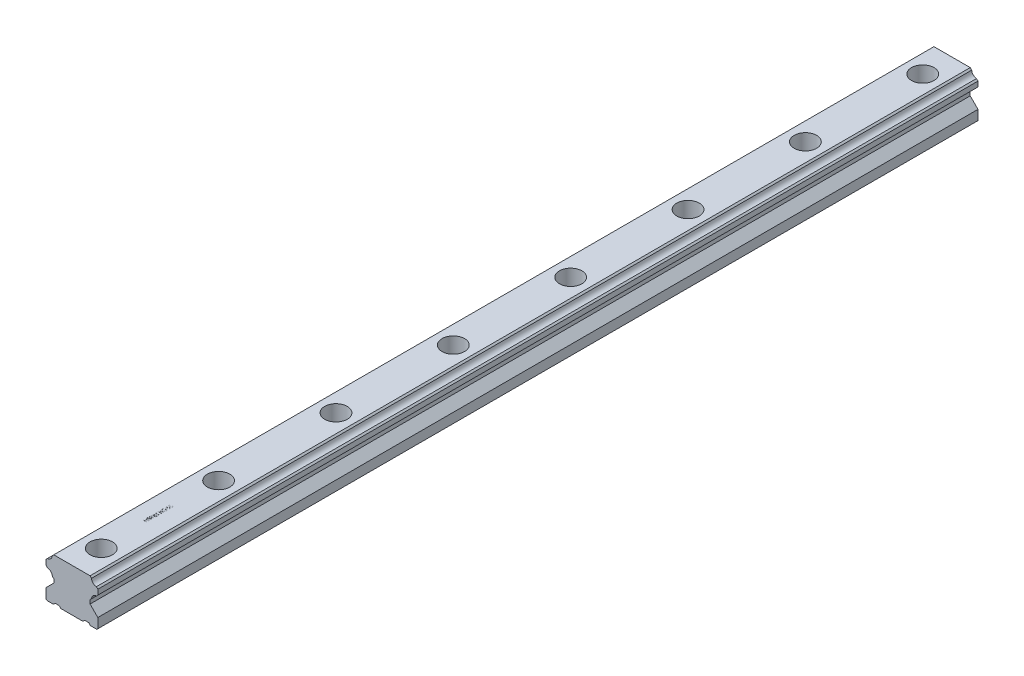
from build123d import *

# Parameters (mm, degrees)
EXTRUDE_1_DEPTH           = 900
HOLE_WIZARD_1_D           = 16
HOLE_WIZARD_1_CBORE_D     = 23
HOLE_WIZARD_1_CBORE_DEPTH = 20
PATTERN_LINEAR_1_COUNT    = 8
PATTERN_LINEAR_1_PITCH    = 120
SKETCH_6_W                = 3.5
SKETCH_6_H                = 0.314102564
CUT_EXTRUDE_1_DEPTH       = 0.1


with BuildPart() as part:
    # 草图1 → 凸台-拉伸1 (new body)
    with BuildSketch(Plane.XY):
        with BuildLine():
            Line((26.5, 36.05), (25.003848019, 37.546151981))
            ThreePointArc((25.003848019, 37.546151981), (21.588083515, 39.088083515), (20.046151981, 42.503848019))
            Line((20.046151981, 42.503848019), (18.55, 44))
            Line((18.55, 44), (-18.55, 44))
            Line((-18.55, 44), (-20.046151981, 42.503848019))
            ThreePointArc((-20.046151981, 42.503848019), (-21.588083515, 39.088083515), (-25.003848019, 37.546151981))
            Line((-25.003848019, 37.546151981), (-26.5, 36.05))
            Line((-26.5, 36.05), (-26.5, 30.8))
            Line((-26.5, 30.8), (-25.003848019, 29.303848019))
            ThreePointArc((-25.003848019, 29.303848019), (-21.588083515, 27.761916485), (-20.046151981, 24.346151981))
            Line((-20.046151981, 24.346151981), (-18.55, 22.85))
            Line((-18.55, 22.85), (-18.55, 18.95))
            Line((-18.55, 18.95), (-26.5, 11))
            Line((-26.5, 11), (-26.5, 1))
            Line((-26.5, 1), (-25.5, 0))
            Line((-25.5, 0), (-18.928571429, 0))
            Line((-18.928571429, 0), (-17.161904762, 1.766666667))
            Line((-17.161904762, 1.766666667), (-13.123809524, 1.766666667))
            Line((-13.123809524, 1.766666667), (-11.357142857, 0))
            Line((-11.357142857, 0), (11.357142857, 0))
            Line((11.357142857, 0), (13.123809524, 1.766666667))
            Line((13.123809524, 1.766666667), (17.161904762, 1.766666667))
            Line((17.161904762, 1.766666667), (18.928571429, 0))
            Line((18.928571429, 0), (25.5, 0))
            Line((25.5, 0), (26.5, 1))
            Line((26.5, 1), (26.5, 11))
            Line((26.5, 11), (18.55, 18.95))
            Line((18.55, 18.95), (18.55, 22.85))
            Line((18.55, 22.85), (20.046151981, 24.346151981))
            ThreePointArc((20.046151981, 24.346151981), (21.588083515, 27.761916485), (25.003848019, 29.303848019))
            Line((25.003848019, 29.303848019), (26.5, 30.8))
            Line((26.5, 30.8), (26.5, 36.05))
        make_face()
    extrude(amount=-EXTRUDE_1_DEPTH)

    # 打孔尺寸根据内六角圆柱头螺钉的类型1 (through all)
    with Locations(Plane(origin=(-6.515963484, 44, -115.068961562), x_dir=(-1, 0, 0), z_dir=(0, 1, 0))):
        with Locations((-6.515963484, 85.068961562)):
            hole_wizard_1 = CounterBoreHole(HOLE_WIZARD_1_D / 2, HOLE_WIZARD_1_CBORE_D / 2, HOLE_WIZARD_1_CBORE_DEPTH)

    # 阵列(线性)1: 打孔尺寸根据内六角圆柱头螺钉的类型1 ×8
    with Locations(*[(0, 0, -i * PATTERN_LINEAR_1_PITCH) for i in range(1, PATTERN_LINEAR_1_COUNT)]):
        add(hole_wizard_1, mode=Mode.SUBTRACT)

    # 草图6 → 切除-拉伸1 (cut)
    with BuildSketch(Plane(origin=(0, 44, 0), x_dir=(1, 0, 0), z_dir=(0, 1, 0))):
        Polygon((-3.5, 76.403846154), (-3.5, 76.717948718), (-2.064102564, 76.717948718), (-2.064102564, 78.512820513), (-3.5, 78.512820513), (-3.5, 78.826923077), (0, 78.826923077), (0, 78.512820513), (-1.705128205, 78.512820513), (-1.705128205, 76.717948718), (0, 76.717948718), (0, 76.403846154), align=None)
        with Locations((-1.75, 79.881410256)):
            Rectangle(SKETCH_6_W, SKETCH_6_H)
        Polygon((-3.5, 80.576923077), (-3.5, 80.901542468), (-0.933193109, 81.586538462), (-3.5, 82.605268429), (-3.5, 82.650841346), (-0.950721154, 83.650641026), (-3.5, 84.339142628), (-3.5, 84.66025641), (0, 83.716546474), (0, 83.671674679), (-2.676883013, 82.618589744), (0, 81.552884615), (0, 81.508012821), align=None)
        with Locations((-1.75, 85.625)):
            Rectangle(SKETCH_6_W, SKETCH_6_H)
        Polygon((0, 86.544871795), (-3.5, 86.544871795), (-3.5, 86.610777244), (-0.745292468, 88.923076923), (-3.5, 88.923076923), (-3.5, 89.237179487), (0, 89.237179487), (0, 89.165665064), (-2.748397436, 86.858974359), (0, 86.858974359), align=None)
        Polygon((-3.5, 91.480769231), (-3.5, 91.794871795), (-2.064102564, 91.794871795), (-2.064102564, 93.58974359), (-3.5, 93.58974359), (-3.5, 93.903846154), (0, 93.903846154), (0, 93.58974359), (-1.705128205, 93.58974359), (-1.705128205, 91.794871795), (0, 91.794871795), (0, 91.480769231), align=None)
        with BuildLine():
            Line((-2.902644231, 98.076923077), (-2.647435897, 97.807692308))
            add(Edge.make_bspline(
                [(-2.647435897, 97.807692308), (-2.69328212, 97.758983227), (-2.783881335, 97.662726562), (-2.901244074, 97.50552662), (-3.002777003, 97.342170767), (-3.084772592, 97.172394867), (-3.149094254, 97.000650867), (-3.195850217, 96.829891913), (-3.225460377, 96.661223615), (-3.229016796, 96.549059313), (-3.230769231, 96.493790064)],
                knots=[0, 0, 0, 0, 1.089067066, 2.152164705, 3.18986567, 4.218445106, 5.218487318, 6.173592265, 7.100032889, 8, 8, 8, 8], degree=3))
            add(Edge.make_bspline(
                [(-3.230769231, 96.493790064), (-3.230355625, 96.459875364), (-3.229529486, 96.392133924), (-3.218985271, 96.29151198), (-3.203820407, 96.191945342), (-3.181878529, 96.093621968), (-3.15406947, 95.99635068), (-3.119284004, 95.900469793), (-3.078728771, 95.805800421), (-3.031866252, 95.713234402), (-2.980386575, 95.623493669), (-2.923337414, 95.538737672), (-2.862550889, 95.458421211), (-2.796491613, 95.384072004), (-2.725807311, 95.31519549), (-2.651770944, 95.250524789), (-2.572926872, 95.191265211), (-2.489599321, 95.138479571), (-2.403726867, 95.090811977), (-2.316037795, 95.049619777), (-2.227346143, 95.013809823), (-2.136984078, 94.986535862), (-2.045883197, 94.963434988), (-1.953566086, 94.947353752), (-1.859791669, 94.938257435), (-1.796993971, 94.936686944), (-1.765424679, 94.935897436)],
                knots=[0, 0, 0, 0, 1.028150113, 2.053633673, 3.06513288, 4.081487945, 5.106702018, 6.131327874, 7.172780699, 8.228344599, 9.276313556, 10.308389736, 11.324843658, 12.329040066, 13.321460474, 14.316307835, 15.308626991, 16.309440696, 17.305625405, 18.28535951, 19.246194545, 20.203493668, 21.145557131, 22.095268976, 23.042464743, 24, 24, 24, 24], degree=3))
            add(Edge.make_bspline(
                [(-1.765424679, 94.935897436), (-1.733154018, 94.936653631), (-1.668700816, 94.938163957), (-1.572504414, 94.947817154), (-1.477747832, 94.965772364), (-1.384282029, 94.989584114), (-1.291920993, 95.019856789), (-1.20076111, 95.057049303), (-1.110811241, 95.101355435), (-1.022964324, 95.152526704), (-0.937464192, 95.209036172), (-0.856251713, 95.271187356), (-0.780271995, 95.339084893), (-0.708415252, 95.411483836), (-0.641134974, 95.489043832), (-0.579242122, 95.572517364), (-0.521779643, 95.660735956), (-0.469378807, 95.753738745), (-0.42257144, 95.850542725), (-0.38094723, 95.949799156), (-0.346667976, 96.051827058), (-0.31872985, 96.156089724), (-0.295829559, 96.262463002), (-0.281097077, 96.371486803), (-0.270406246, 96.482359512), (-0.269624576, 96.557098144), (-0.269230769, 96.594751603)],
                knots=[0, 0, 0, 0, 0.935915162, 1.869274651, 2.799799983, 3.730201895, 4.664668062, 5.616159355, 6.583070886, 7.570012957, 8.562524459, 9.553461134, 10.53281078, 11.515274572, 12.509912756, 13.507571325, 14.526460018, 15.561318395, 16.601025881, 17.643204557, 18.680545676, 19.719612342, 20.772381578, 21.833430283, 22.908478249, 24, 24, 24, 24], degree=3))
            add(Edge.make_bspline(
                [(-0.269230769, 96.594751603), (-0.270178952, 96.640130135), (-0.272040863, 96.729238255), (-0.286546735, 96.860222075), (-0.309173205, 96.986034693), (-0.342412256, 97.106266531), (-0.384484705, 97.221353926), (-0.436513285, 97.330872414), (-0.497950569, 97.435124408), (-0.567552463, 97.533658668), (-0.645100929, 97.624132689), (-0.728035637, 97.706474768), (-0.817431068, 97.77785339), (-0.911954918, 97.840400707), (-1.012511326, 97.892097951), (-1.118540888, 97.934543829), (-1.230109213, 97.967076285), (-1.307200733, 97.980431374), (-1.346153846, 97.987179487)],
                knots=[0, 0, 0, 0, 1.130199668, 2.219330667, 3.279027493, 4.311506524, 5.322739849, 6.327972234, 7.327472899, 8.33386792, 9.329086447, 10.29244429, 11.240784345, 12.174119183, 13.111530729, 14.052100829, 15.015757696, 16, 16, 16, 16], degree=3))
            Line((-1.346153846, 97.987179487), (-1.346153846, 96.820512821))
            Line((-1.346153846, 96.820512821), (-1.705128205, 96.820512821))
            Line((-1.705128205, 96.820512821), (-1.705128205, 98.301282051))
            add(Edge.make_bspline(
                [(-1.705128205, 98.301282051), (-1.638220716, 98.299576203), (-1.507270675, 98.296237549), (-1.316300404, 98.272818634), (-1.13592871, 98.235002122), (-0.965965639, 98.18334181), (-0.806652046, 98.116466529), (-0.65782618, 98.035094001), (-0.520449499, 97.93792188), (-0.393400495, 97.828411438), (-0.280071283, 97.705511481), (-0.180465345, 97.572542861), (-0.09656273, 97.429285892), (-0.028302067, 97.275876085), (0.024971927, 97.112815651), (0.062743504, 96.939727272), (0.085373467, 96.756845671), (0.088264847, 96.631508994), (0.08974359, 96.567407853)],
                knots=[0, 0, 0, 0, 1.140356446, 2.231883559, 3.274166699, 4.278491846, 5.25512956, 6.21435461, 7.1637429, 8.11826594, 9.068280886, 10.0076534, 10.945064095, 11.891975133, 12.864533718, 13.863980011, 14.907571808, 16, 16, 16, 16], degree=3))
            add(Edge.make_bspline(
                [(0.08974359, 96.567407853), (0.089174469, 96.527897717), (0.088051978, 96.449970996), (0.080074631, 96.334880068), (0.067794054, 96.222962448), (0.049248931, 96.114234439), (0.026534277, 96.008296097), (-0.002552442, 95.905676512), (-0.036221141, 95.80598477), (-0.074516815, 95.709066784), (-0.118888472, 95.615802237), (-0.168198111, 95.52577572), (-0.222191472, 95.438489595), (-0.281802318, 95.35453843), (-0.346584778, 95.273484808), (-0.416668697, 95.195851364), (-0.491839816, 95.121203486), (-0.545218826, 95.074443023), (-0.572115385, 95.05088141)],
                knots=[0, 0, 0, 0, 1.107784379, 2.184907829, 3.233506516, 4.263428166, 5.276301166, 6.270063455, 7.25232949, 8.225834625, 9.190232166, 10.146266622, 11.1027726, 12.066435141, 13.031522626, 14.010570082, 14.99756817, 16, 16, 16, 16], degree=3))
            add(Edge.make_bspline(
                [(-0.572115385, 95.05088141), (-0.614786038, 95.016695478), (-0.699419055, 94.948891066), (-0.835018999, 94.861612909), (-0.975420859, 94.787211506), (-1.121015488, 94.726843684), (-1.271666701, 94.679705598), (-1.427181992, 94.645899345), (-1.587761622, 94.626092056), (-1.696426887, 94.623238518), (-1.751402244, 94.621794872)],
                knots=[0, 0, 0, 0, 1.023165419, 2.029347347, 3.013907458, 3.994755782, 4.975994455, 5.96558838, 6.970761222, 8, 8, 8, 8], degree=3))
            add(Edge.make_bspline(
                [(-1.751402244, 94.621794872), (-1.792568496, 94.62232711), (-1.874377804, 94.623384821), (-1.99583511, 94.636210339), (-2.115135808, 94.654611751), (-2.232182344, 94.681658827), (-2.347053012, 94.715755013), (-2.45980069, 94.758308794), (-2.570493643, 94.807852572), (-2.67836343, 94.865442289), (-2.782003044, 94.929511026), (-2.880905313, 94.999118682), (-2.973467332, 95.074802367), (-3.059903521, 95.156782462), (-3.141494975, 95.243406392), (-3.216537375, 95.336492693), (-3.286205011, 95.434631029), (-3.349159221, 95.538582169), (-3.405727075, 95.6467058), (-3.455315154, 95.758766886), (-3.496298775, 95.874724704), (-3.531072472, 95.993712261), (-3.556787635, 96.11662974), (-3.575436374, 96.242585283), (-3.588196976, 96.372235393), (-3.589223231, 96.459871423), (-3.58974359, 96.504306891)],
                knots=[0, 0, 0, 0, 1.00895651, 2.005089799, 2.991467152, 3.967318338, 4.948153826, 5.927364234, 6.919980553, 7.91976625, 8.923240147, 9.905815003, 10.88314567, 11.851989312, 12.825009789, 13.798721852, 14.781296708, 15.773896486, 16.776076962, 17.771600213, 18.775744723, 19.78957137, 20.808953803, 21.851964491, 22.910847925, 24, 24, 24, 24], degree=3))
            add(Edge.make_bspline(
                [(-3.58974359, 96.504306891), (-3.589164098, 96.540545135), (-3.588015034, 96.612401313), (-3.580050386, 96.719327046), (-3.567426505, 96.82460006), (-3.550199718, 96.92837645), (-3.526736028, 97.030302816), (-3.498657743, 97.130669522), (-3.46596592, 97.229622058), (-3.426977074, 97.326850307), (-3.382723449, 97.423008023), (-3.332910027, 97.518629864), (-3.276685022, 97.61338911), (-3.213881487, 97.707450091), (-3.145578069, 97.801405949), (-3.069821245, 97.893770591), (-2.989598489, 97.986773536), (-2.931916305, 98.04657535), (-2.902644231, 98.076923077)],
                knots=[0, 0, 0, 0, 0.985871117, 1.954866573, 2.915460327, 3.869826059, 4.81536089, 5.759505086, 6.70452669, 7.649098992, 8.607881297, 9.583363685, 10.581137262, 11.603961102, 12.659522466, 13.73993555, 14.853081303, 16, 16, 16, 16], degree=3))
        make_face()
        with BuildLine():
            Line((-3.5, 100.903846154), (-3.141025641, 100.903846154))
            Line((-3.141025641, 100.903846154), (-3.141025641, 99.713341346))
            Line((-3.141025641, 99.713341346), (-2.220452724, 99.524739583))
            add(Edge.make_bspline(
                [(-2.220452724, 99.524739583), (-2.230682996, 99.561795458), (-2.25050253, 99.633585354), (-2.2725083, 99.739545215), (-2.285773744, 99.840137418), (-2.287585055, 99.905412788), (-2.288461538, 99.936999199)],
                knots=[0, 0, 0, 0, 1.100273476, 2.13160584, 3.095893838, 4, 4, 4, 4], degree=3))
            add(Edge.make_bspline(
                [(-2.288461538, 99.936999199), (-2.28764354, 99.976090113), (-2.28603515, 100.052952616), (-2.269673986, 100.165236922), (-2.245976174, 100.272964258), (-2.209465207, 100.37454404), (-2.164878805, 100.471583362), (-2.108721258, 100.562415693), (-2.04315746, 100.648315868), (-1.968525078, 100.728690187), (-1.885534459, 100.801263185), (-1.795933934, 100.864326729), (-1.701678739, 100.919369504), (-1.600559725, 100.962297929), (-1.494484031, 100.997331711), (-1.382227183, 101.020433075), (-1.264785773, 101.035863785), (-1.18448027, 101.037584225), (-1.143529647, 101.038461538)],
                knots=[0, 0, 0, 0, 1.052805225, 2.070078116, 3.052532748, 4.020689046, 4.973125432, 5.925915817, 6.89216474, 7.881560752, 8.877013184, 9.857446635, 10.830895175, 11.812622661, 12.812548702, 13.836681939, 14.896847428, 16, 16, 16, 16], degree=3))
            add(Edge.make_bspline(
                [(-1.143529647, 101.038461538), (-1.115007605, 101.037795864), (-1.058348972, 101.036473511), (-0.974202158, 101.029763707), (-0.891849045, 101.016795315), (-0.811440613, 100.999595198), (-0.732901554, 100.976633891), (-0.65579213, 100.949776469), (-0.580956685, 100.91639447), (-0.508064701, 100.879386796), (-0.437950402, 100.838407772), (-0.372294905, 100.79232777), (-0.309599937, 100.744447993), (-0.251727444, 100.692130497), (-0.198452948, 100.635970103), (-0.149513072, 100.576279294), (-0.104029493, 100.513599475), (-0.063861909, 100.446943445), (-0.026898788, 100.377801175), (0.003424705, 100.3051729), (0.030535245, 100.230712215), (0.05214477, 100.153347336), (0.069077325, 100.073253524), (0.080577925, 99.990298748), (0.088954363, 99.904918078), (0.08947872, 99.847043066), (0.08974359, 99.817808494)],
                knots=[0, 0, 0, 0, 1.056393913, 2.098511576, 3.122979385, 4.141471433, 5.141222888, 6.151259816, 7.162667642, 8.172852865, 9.177685681, 10.166741883, 11.141342384, 12.097242845, 13.052202613, 14.005160326, 14.953864445, 15.917140761, 16.884916217, 17.854238259, 18.828761908, 19.81781811, 20.826036654, 21.857789401, 22.917898972, 24, 24, 24, 24], degree=3))
            add(Edge.make_bspline(
                [(0.08974359, 99.817808494), (0.089050894, 99.782935202), (0.087688097, 99.714326121), (0.073496095, 99.613792878), (0.053035464, 99.517124563), (0.022721931, 99.424735484), (-0.016971483, 99.337010956), (-0.064133263, 99.252694783), (-0.12027864, 99.172832026), (-0.184894072, 99.097968685), (-0.255892818, 99.029152679), (-0.332202561, 98.966749818), (-0.413920487, 98.911886181), (-0.500780871, 98.864362752), (-0.592629648, 98.823877123), (-0.689749822, 98.792058716), (-0.791650601, 98.766381298), (-0.861804004, 98.755517748), (-0.897435897, 98.75)],
                knots=[0, 0, 0, 0, 1.046872515, 2.059598001, 3.044168548, 4.012104806, 4.973680974, 5.932408326, 6.910122221, 7.900780896, 8.89867654, 9.876692837, 10.858029398, 11.85084981, 12.847361615, 13.868568023, 14.917415949, 16, 16, 16, 16], degree=3))
            Line((-0.897435897, 98.75), (-0.897435897, 99.064102564))
            add(Edge.make_bspline(
                [(-0.897435897, 99.064102564), (-0.86405597, 99.071826286), (-0.799897896, 99.08667171), (-0.709812799, 99.119341801), (-0.62950762, 99.158898767), (-0.558491359, 99.207032704), (-0.495464081, 99.2628261), (-0.43989307, 99.327683039), (-0.389697273, 99.399982119), (-0.347784769, 99.480364497), (-0.312479137, 99.56533256), (-0.287283878, 99.653755658), (-0.272032646, 99.744361212), (-0.270168243, 99.805363831), (-0.269230769, 99.83603766)],
                knots=[0, 0, 0, 0, 1.13623081, 2.183898708, 3.172478118, 4.09966615, 5.022692284, 5.957376522, 6.927682873, 7.937366477, 8.960015386, 9.976409503, 10.982481913, 12, 12, 12, 12], degree=3))
            add(Edge.make_bspline(
                [(-0.269230769, 99.83603766), (-0.270058415, 99.865993563), (-0.271688055, 99.924976981), (-0.284028564, 100.01182482), (-0.303533592, 100.095428074), (-0.33085902, 100.175935151), (-0.367008958, 100.252950452), (-0.411417074, 100.326365089), (-0.462975425, 100.397224915), (-0.521904738, 100.463665008), (-0.586881759, 100.52450125), (-0.656357238, 100.578258209), (-0.730474586, 100.623034903), (-0.807947606, 100.66076907), (-0.889626199, 100.689422353), (-0.975127364, 100.709863339), (-1.064662347, 100.721866396), (-1.125731657, 100.723517577), (-1.156850962, 100.724358974)],
                knots=[0, 0, 0, 0, 1.027268864, 2.022700798, 3.002744649, 3.968653148, 4.933396556, 5.915045722, 6.907600446, 7.935526002, 8.956456544, 9.95700807, 10.942805781, 11.92166854, 12.907987664, 13.905483474, 14.932689774, 16, 16, 16, 16], degree=3))
            add(Edge.make_bspline(
                [(-1.156850962, 100.724358974), (-1.184930032, 100.723720502), (-1.239659043, 100.722476054), (-1.320009695, 100.71170295), (-1.396158478, 100.693706649), (-1.468436727, 100.668083572), (-1.536613353, 100.636105153), (-1.600538112, 100.595955279), (-1.660812066, 100.549343566), (-1.715884112, 100.494925447), (-1.766793088, 100.435729798), (-1.810034281, 100.370236173), (-1.846807397, 100.300193009), (-1.876936465, 100.225470504), (-1.900936575, 100.145976618), (-1.917523378, 100.061668535), (-1.92744867, 99.972527041), (-1.928795087, 99.911551397), (-1.929487179, 99.880208333)],
                knots=[0, 0, 0, 0, 1.045723156, 2.038222538, 3.013889863, 3.95567481, 4.890389958, 5.81331128, 6.76251276, 7.723027653, 8.692928204, 9.666105983, 10.639751036, 11.635719707, 12.66315958, 13.728667616, 14.832476222, 16, 16, 16, 16], degree=3))
            add(Edge.make_bspline(
                [(-1.929487179, 99.880208333), (-1.928906588, 99.853079405), (-1.927707815, 99.797065049), (-1.918881318, 99.711142222), (-1.904642024, 99.620850499), (-1.885055776, 99.526536004), (-1.859424699, 99.427915496), (-1.828710199, 99.325197095), (-1.7919882, 99.218164829), (-1.764255986, 99.146047104), (-1.75, 99.108974359)],
                knots=[0, 0, 0, 0, 0.817624296, 1.688186739, 2.600797293, 3.572016777, 4.590301741, 5.671205678, 6.80286297, 8, 8, 8, 8], degree=3))
            Line((-1.75, 99.108974359), (-3.5, 99.467948718))
            Line((-3.5, 99.467948718), (-3.5, 100.903846154))
        make_face()
        with BuildLine():
            Line((-3.5, 103.596153846), (-3.141025641, 103.596153846))
            Line((-3.141025641, 103.596153846), (-3.141025641, 102.405649038))
            Line((-3.141025641, 102.405649038), (-2.220452724, 102.217047276))
            add(Edge.make_bspline(
                [(-2.220452724, 102.217047276), (-2.230682996, 102.25410315), (-2.25050253, 102.325893046), (-2.2725083, 102.431852907), (-2.285773744, 102.53244511), (-2.287585055, 102.597720481), (-2.288461538, 102.629306891)],
                knots=[0, 0, 0, 0, 1.100273476, 2.13160584, 3.095893838, 4, 4, 4, 4], degree=3))
            add(Edge.make_bspline(
                [(-2.288461538, 102.629306891), (-2.28764354, 102.668397805), (-2.28603515, 102.745260309), (-2.269673986, 102.857544614), (-2.245976174, 102.96527195), (-2.209465207, 103.066851732), (-2.164878805, 103.163891055), (-2.108721258, 103.254723386), (-2.04315746, 103.34062356), (-1.968525078, 103.420997879), (-1.885534459, 103.493570878), (-1.795933934, 103.556634421), (-1.701678739, 103.611677196), (-1.600559725, 103.654605621), (-1.494484031, 103.689639403), (-1.382227183, 103.712740767), (-1.264785773, 103.728171477), (-1.18448027, 103.729891917), (-1.143529647, 103.730769231)],
                knots=[0, 0, 0, 0, 1.052805225, 2.070078116, 3.052532748, 4.020689046, 4.973125432, 5.925915817, 6.89216474, 7.881560752, 8.877013184, 9.857446635, 10.830895175, 11.812622661, 12.812548702, 13.836681939, 14.896847428, 16, 16, 16, 16], degree=3))
            add(Edge.make_bspline(
                [(-1.143529647, 103.730769231), (-1.115007605, 103.730103556), (-1.058348972, 103.728781204), (-0.974202158, 103.7220714), (-0.891849045, 103.709103007), (-0.811440613, 103.69190289), (-0.732901554, 103.668941583), (-0.65579213, 103.642084161), (-0.580956685, 103.608702163), (-0.508064701, 103.571694489), (-0.437950402, 103.530715464), (-0.372294905, 103.484635462), (-0.309599937, 103.436755685), (-0.251727444, 103.384438189), (-0.198452948, 103.328277796), (-0.149513072, 103.268586987), (-0.104029493, 103.205907167), (-0.063861909, 103.139251137), (-0.026898788, 103.070108867), (0.003424705, 102.997480593), (0.030535245, 102.923019908), (0.05214477, 102.845655028), (0.069077325, 102.765561217), (0.080577925, 102.682606441), (0.088954363, 102.597225771), (0.08947872, 102.539350758), (0.08974359, 102.510116186)],
                knots=[0, 0, 0, 0, 1.056393913, 2.098511576, 3.122979385, 4.141471433, 5.141222888, 6.151259816, 7.162667642, 8.172852865, 9.177685681, 10.166741883, 11.141342384, 12.097242845, 13.052202613, 14.005160326, 14.953864445, 15.917140761, 16.884916217, 17.854238259, 18.828761908, 19.81781811, 20.826036654, 21.857789401, 22.917898972, 24, 24, 24, 24], degree=3))
            add(Edge.make_bspline(
                [(0.08974359, 102.510116186), (0.089050894, 102.475242894), (0.087688097, 102.406633813), (0.073496095, 102.30610057), (0.053035464, 102.209432256), (0.022721931, 102.117043177), (-0.016971483, 102.029318648), (-0.064133263, 101.945002475), (-0.12027864, 101.865139718), (-0.184894072, 101.790276377), (-0.255892818, 101.721460371), (-0.332202561, 101.65905751), (-0.413920487, 101.604193873), (-0.500780871, 101.556670445), (-0.592629648, 101.516184815), (-0.689749822, 101.484366409), (-0.791650601, 101.45868899), (-0.861804004, 101.447825441), (-0.897435897, 101.442307692)],
                knots=[0, 0, 0, 0, 1.046872515, 2.059598001, 3.044168548, 4.012104806, 4.973680974, 5.932408326, 6.910122221, 7.900780896, 8.89867654, 9.876692837, 10.858029398, 11.85084981, 12.847361615, 13.868568023, 14.917415949, 16, 16, 16, 16], degree=3))
            Line((-0.897435897, 101.442307692), (-0.897435897, 101.756410256))
            add(Edge.make_bspline(
                [(-0.897435897, 101.756410256), (-0.86405597, 101.764133979), (-0.799897896, 101.778979402), (-0.709812799, 101.811649494), (-0.62950762, 101.851206459), (-0.558491359, 101.899340396), (-0.495464081, 101.955133792), (-0.43989307, 102.019990731), (-0.389697273, 102.092289811), (-0.347784769, 102.17267219), (-0.312479137, 102.257640252), (-0.287283878, 102.346063351), (-0.272032646, 102.436668904), (-0.270168243, 102.497671524), (-0.269230769, 102.528345353)],
                knots=[0, 0, 0, 0, 1.13623081, 2.183898708, 3.172478118, 4.09966615, 5.022692284, 5.957376522, 6.927682873, 7.937366477, 8.960015386, 9.976409503, 10.982481913, 12, 12, 12, 12], degree=3))
            add(Edge.make_bspline(
                [(-0.269230769, 102.528345353), (-0.270058415, 102.558301256), (-0.271688055, 102.617284674), (-0.284028564, 102.704132513), (-0.303533592, 102.787735767), (-0.33085902, 102.868242843), (-0.367008958, 102.945258145), (-0.411417074, 103.018672781), (-0.462975425, 103.089532607), (-0.521904738, 103.1559727), (-0.586881759, 103.216808942), (-0.656357238, 103.270565902), (-0.730474586, 103.315342595), (-0.807947606, 103.353076763), (-0.889626199, 103.381730046), (-0.975127364, 103.402171031), (-1.064662347, 103.414174089), (-1.125731657, 103.415825269), (-1.156850962, 103.416666667)],
                knots=[0, 0, 0, 0, 1.027268864, 2.022700798, 3.002744649, 3.968653148, 4.933396556, 5.915045722, 6.907600446, 7.935526002, 8.956456544, 9.95700807, 10.942805781, 11.92166854, 12.907987664, 13.905483474, 14.932689774, 16, 16, 16, 16], degree=3))
            add(Edge.make_bspline(
                [(-1.156850962, 103.416666667), (-1.184930032, 103.416028195), (-1.239659043, 103.414783746), (-1.320009695, 103.404010642), (-1.396158478, 103.386014341), (-1.468436727, 103.360391264), (-1.536613353, 103.328412845), (-1.600538112, 103.288262971), (-1.660812066, 103.241651258), (-1.715884112, 103.187233139), (-1.766793088, 103.12803749), (-1.810034281, 103.062543866), (-1.846807397, 102.992500701), (-1.876936465, 102.917778197), (-1.900936575, 102.838284311), (-1.917523378, 102.753976228), (-1.92744867, 102.664834733), (-1.928795087, 102.603859089), (-1.929487179, 102.572516026)],
                knots=[0, 0, 0, 0, 1.045723156, 2.038222538, 3.013889863, 3.95567481, 4.890389958, 5.81331128, 6.76251276, 7.723027653, 8.692928204, 9.666105983, 10.639751036, 11.635719707, 12.66315958, 13.728667616, 14.832476222, 16, 16, 16, 16], degree=3))
            add(Edge.make_bspline(
                [(-1.929487179, 102.572516026), (-1.928906588, 102.545387097), (-1.927707815, 102.489372742), (-1.918881318, 102.403449915), (-1.904642024, 102.313158192), (-1.885055776, 102.218843696), (-1.859424699, 102.120223188), (-1.828710199, 102.017504787), (-1.7919882, 101.910472521), (-1.764255986, 101.838354796), (-1.75, 101.801282051)],
                knots=[0, 0, 0, 0, 0.817624296, 1.688186739, 2.600797293, 3.572016777, 4.590301741, 5.671205678, 6.80286297, 8, 8, 8, 8], degree=3))
            Line((-1.75, 101.801282051), (-3.5, 102.16025641))
            Line((-3.5, 102.16025641), (-3.5, 103.596153846))
        make_face()
    extrude(amount=-CUT_EXTRUDE_1_DEPTH, mode=Mode.SUBTRACT)


solid = part.part
